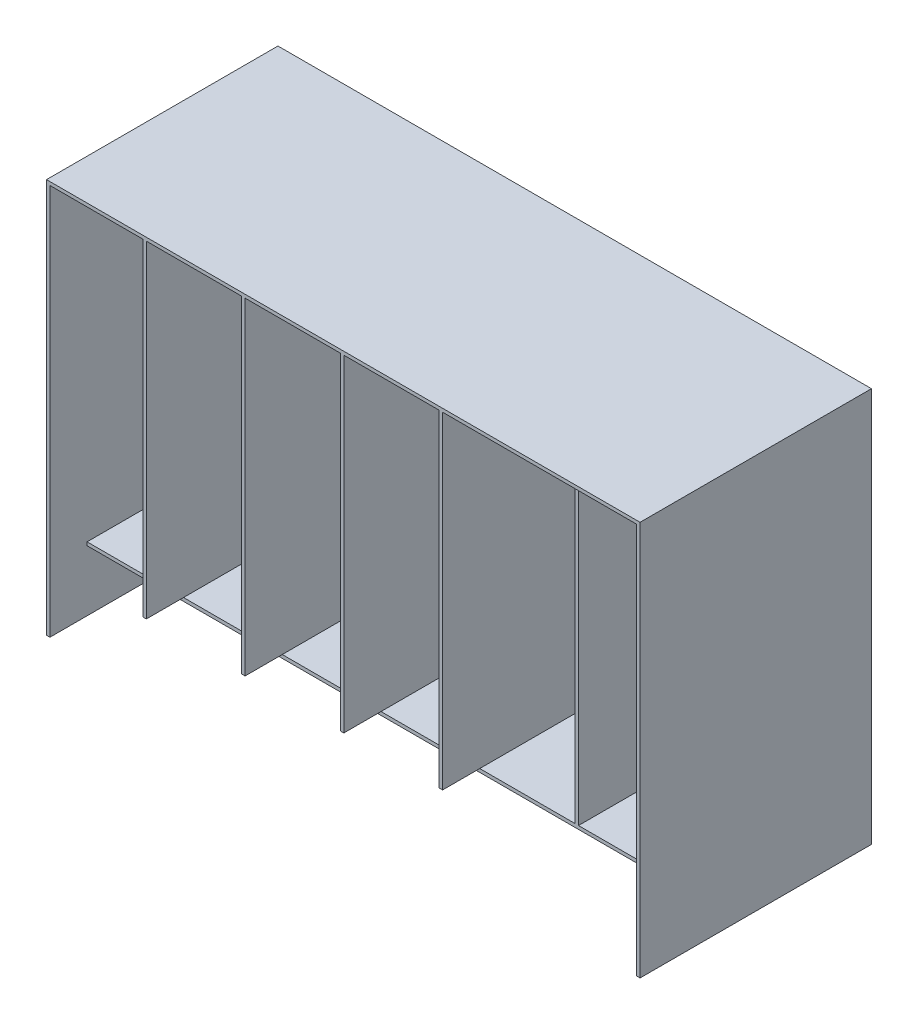
from build123d import *

# Parameters (mm, degrees)
SKETCH1_W           = 558.803
SKETCH1_H           = 314.432
SKETCH1_W_2         = 552.453
SKETCH1_H_2         = 308.082
SKETCH1_W_3         = 3.175
SKETCH1_W_4         = 89.789
SKETCH1_W_5         = 87.632
SKETCH1_W_6         = 89.79
SKETCH1_H_3         = 57.15
BOSS_EXTRUDE1_DEPTH = 3.175
SKETCH2_W           = 558.803
SKETCH2_H           = 371.582
SKETCH2_W_2         = 89.79
SKETCH2_H_2         = 308.082
SKETCH2_W_3         = 89.789
SKETCH2_W_4         = 552.453
SKETCH2_H_3         = 53.975
SKETCH2_W_5         = 87.632
BOSS_EXTRUDE2_DEPTH = 176.6
SKETCH4_W           = 552.453
SKETCH4_H           = 176.6
CUT_EXTRUDE1_DEPTH  = 3.175
SKETCH5_W           = 87.632
SKETCH5_H           = 308.082
SKETCH5_W_2         = 89.789
SKETCH5_W_3         = 89.79
BOSS_EXTRUDE5_DEPTH = 38.1
SKETCH7_W           = 3.175
SKETCH7_H           = 308.082
CUT_EXTRUDE2_DEPTH  = 35


with BuildPart() as part:
    # Sketch1 → Boss-Extrude1 (new body)
    # profile 1 of 13: a face of its own
    with BuildSketch(Plane.XY):
        Rectangle(SKETCH1_W, SKETCH1_H)
        Rectangle(SKETCH1_W_2, SKETCH1_H_2, mode=Mode.SUBTRACT)
    # profile 2 of 13: a face of its own
    with BuildSketch(Plane.XY):
        with Locations((-187.007, 0)):
            Rectangle(SKETCH1_W_3, SKETCH1_H_2)
    # profile 3 of 13: a face of its own
    with BuildSketch(Plane.XY):
        with Locations((-140.525, 0)):
            Rectangle(SKETCH1_W_4, SKETCH1_H_2)
    # profile 4 of 13: a face of its own
    with BuildSketch(Plane.XY):
        with Locations((-232.4105, 0)):
            Rectangle(SKETCH1_W_5, SKETCH1_H_2)
    # profile 5 of 13: a face of its own
    with BuildSketch(Plane.XY):
        with Locations((-47.561, 0)):
            Rectangle(SKETCH1_W_4, SKETCH1_H_2)
    # profile 6 of 13: a face of its own
    with BuildSketch(Plane.XY):
        with Locations((-94.043, 0)):
            Rectangle(SKETCH1_W_3, SKETCH1_H_2)
    # profile 7 of 13: a face of its own
    with BuildSketch(Plane.XY):
        with Locations((45.403, 0)):
            Rectangle(SKETCH1_W_4, SKETCH1_H_2)
    # profile 8 of 13: a face of its own
    with BuildSketch(Plane.XY):
        with Locations((-1.079, 0)):
            Rectangle(SKETCH1_W_3, SKETCH1_H_2)
    # profile 9 of 13: a face of its own
    with BuildSketch(Plane.XY):
        with Locations((138.367, 0)):
            Rectangle(SKETCH1_W_4, SKETCH1_H_2)
    # profile 10 of 13: a face of its own
    with BuildSketch(Plane.XY):
        with Locations((91.885, 0)):
            Rectangle(SKETCH1_W_3, SKETCH1_H_2)
    # profile 11 of 13: a face of its own
    with BuildSketch(Plane.XY):
        with Locations((231.3315, 0)):
            Rectangle(SKETCH1_W_6, SKETCH1_H_2)
    # profile 12 of 13: a face of its own
    with BuildSketch(Plane.XY):
        with Locations((184.849, 0)):
            Rectangle(SKETCH1_W_3, SKETCH1_H_2)
    # profile 13 of 13: a face of its own
    with BuildSketch(Plane.XY):
        with Locations((0, -185.791)):
            Rectangle(SKETCH1_W, SKETCH1_H_3)
    extrude(amount=BOSS_EXTRUDE1_DEPTH)

    # Sketch2 → Boss-Extrude2 (add)
    with BuildSketch(Plane.XY.offset(3.175)):
        with Locations((0, -28.575)):
            Rectangle(SKETCH2_W, SKETCH2_H)
        with Locations((231.3315, 0)):
            Rectangle(SKETCH2_W_2, SKETCH2_H_2, mode=Mode.SUBTRACT)
        with Locations((138.367, 0)):
            Rectangle(SKETCH2_W_3, SKETCH2_H_2, mode=Mode.SUBTRACT)
        with Locations((0, -184.2035)):
            Rectangle(SKETCH2_W_4, SKETCH2_H_3, mode=Mode.SUBTRACT)
        with Locations((45.403, 0)):
            Rectangle(SKETCH2_W_3, SKETCH2_H_2, mode=Mode.SUBTRACT)
        with Locations((-47.561, 0)):
            Rectangle(SKETCH2_W_3, SKETCH2_H_2, mode=Mode.SUBTRACT)
        with Locations((-140.525, 0)):
            Rectangle(SKETCH2_W_3, SKETCH2_H_2, mode=Mode.SUBTRACT)
        with Locations((-232.4105, 0)):
            Rectangle(SKETCH2_W_5, SKETCH2_H_2, mode=Mode.SUBTRACT)
    extrude(amount=BOSS_EXTRUDE2_DEPTH)

    # Sketch4 → Cut-Extrude1 (cut)
    with BuildSketch(Plane.XZ.offset(214.366)):
        with Locations((0, 91.475)):
            Rectangle(SKETCH4_W, SKETCH4_H)
    extrude(amount=-CUT_EXTRUDE1_DEPTH, mode=Mode.SUBTRACT)

    # Sketch5 → Boss-Extrude5 (add)
    with BuildSketch(Plane.XY.offset(179.775)):
        Polygon((-279.4015, 157.216), (-279.4015, -214.366), (-276.2265, -214.366), (-276.2265, -157.216), (276.2265, -157.216), (276.2265, -214.366), (279.4015, -214.366), (279.4015, 157.216), align=None)
        with Locations((-232.4105, 0)):
            Rectangle(SKETCH5_W, SKETCH5_H, mode=Mode.SUBTRACT)
        with Locations((-140.525, 0)):
            Rectangle(SKETCH5_W_2, SKETCH5_H, mode=Mode.SUBTRACT)
        with Locations((-47.561, 0)):
            Rectangle(SKETCH5_W_2, SKETCH5_H, mode=Mode.SUBTRACT)
        with Locations((45.403, 0)):
            Rectangle(SKETCH5_W_2, SKETCH5_H, mode=Mode.SUBTRACT)
        with Locations((138.367, 0)):
            Rectangle(SKETCH5_W_2, SKETCH5_H, mode=Mode.SUBTRACT)
        with Locations((231.3315, 0)):
            Rectangle(SKETCH5_W_3, SKETCH5_H, mode=Mode.SUBTRACT)
    extrude(amount=BOSS_EXTRUDE5_DEPTH)

    # Sketch7 → Cut-Extrude2 (cut)
    with BuildSketch(Plane.XY.offset(217.875)):
        Polygon((-185.4195, -154.041), (-188.5945, -154.041), (-276.2265, -154.041), (-276.2265, -157.216), (276.2265, -157.216), (276.2265, -154.041), (186.4365, -154.041), (183.2615, -154.041), (93.4725, -154.041), (90.2975, -154.041), (0.5085, -154.041), (-2.6665, -154.041), (-92.4555, -154.041), (-95.6305, -154.041), align=None)
        with Locations((184.849, 0)):
            Rectangle(SKETCH7_W, SKETCH7_H)
    extrude(amount=-CUT_EXTRUDE2_DEPTH, mode=Mode.SUBTRACT)


solid = part.part
